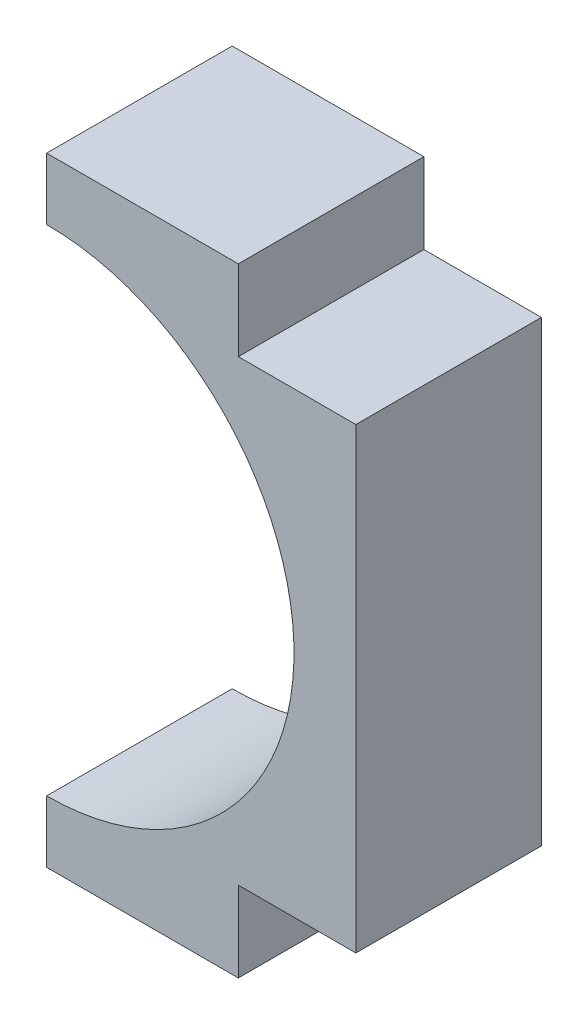
from build123d import *

# Parameters (mm, degrees)
EXTRUDE_1_DEPTH     = 30
SKETCH_2_W          = 19
SKETCH_2_H          = 13
CUT_EXTRUDE_1_DEPTH = 77.811457479


with BuildPart() as part:
    # Эскиз1 → Бобышка-Вытянуть1 (new body)
    with BuildSketch(Plane.XY):
        with BuildLine():
            Line((50, 50), (0, 50))
            Line((0, 50), (0, 40))
            ThreePointArc((0, 40), (28.284271247, 28.284271247), (40, 0))
            ThreePointArc((40, 0), (28.284271247, -28.284271247), (0, -40))
            Line((0, -40), (0, -50))
            Line((0, -50), (50, -50))
            Line((50, -50), (50, 50))
        make_face()
    extrude(amount=EXTRUDE_1_DEPTH)

    # Эскиз2 → Вырез-Вытянуть1 (cut, through all)
    with BuildSketch(Plane.XY.offset(30)):
        with Locations((40.5, 43.5)):
            Rectangle(SKETCH_2_W, SKETCH_2_H)
    cut_extrude_1 = extrude(amount=-CUT_EXTRUDE_1_DEPTH, mode=Mode.SUBTRACT)

    # Зеркальное отражение1: Вырез-Вытянуть1 across plane
    add(cut_extrude_1.mirror(Plane.ZX), mode=Mode.SUBTRACT)


solid = part.part
